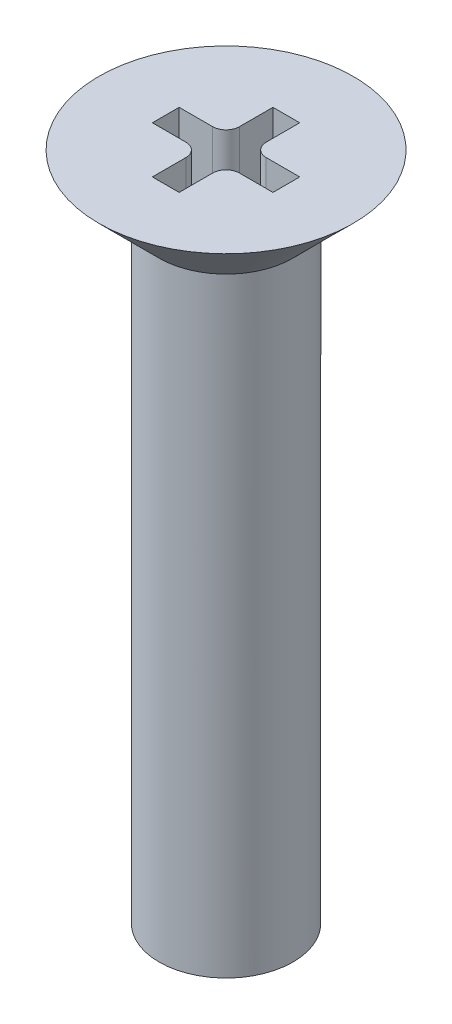
from build123d import *

# Parameters (mm, degrees)
BOSS_EXTRUDE1_START = 8.8
SKETCH2_R           = 1
BOSS_EXTRUDE1_DEPTH = 8.8
CUT_EXTRUDE1_DEPTH  = 1


with BuildPart() as part:
    # Sketch1 → Revolve1 (revolve)
    with BuildSketch(Plane(origin=(0, 0, 0), x_dir=(0, 0, -1), z_dir=(1, 0, 0))):
        Polygon((0, 0), (-1.9, 0), (-1, -0.9), (-1, -1.2), (0, -1.2), align=None)
    revolve(axis=Axis((0, 0.872326939, 0), (0, -1, 0)))

    # Sketch2 → Boss-Extrude1 (add)
    with BuildSketch(Plane.XZ.offset(1.2).offset(BOSS_EXTRUDE1_START)):
        with Locations(Location((0, 0, 0), (0, 0, 90))):
            Circle(SKETCH2_R)
    extrude(amount=-BOSS_EXTRUDE1_DEPTH)

    # Sketch3 → Cut-Extrude1 (cut)
    with BuildSketch(Plane(origin=(0, 0, 0), x_dir=(1, 0, 0), z_dir=(0, 1, 0))):
        with BuildLine():
            Line((-0.9, -0.2), (-0.4, -0.2))
            ThreePointArc((-0.4, -0.2), (-0.258578644, -0.258578644), (-0.2, -0.4))
            Line((-0.2, -0.4), (-0.2, -0.9))
            Line((-0.2, -0.9), (0.2, -0.9))
            Line((0.2, -0.9), (0.2, -0.4))
            ThreePointArc((0.2, -0.4), (0.258578644, -0.258578644), (0.4, -0.2))
            Line((0.4, -0.2), (0.9, -0.2))
            Line((0.9, -0.2), (0.9, 0.2))
            Line((0.9, 0.2), (0.4, 0.2))
            ThreePointArc((0.4, 0.2), (0.258578644, 0.258578644), (0.2, 0.4))
            Line((0.2, 0.4), (0.2, 0.9))
            Line((0.2, 0.9), (-0.2, 0.9))
            Line((-0.2, 0.9), (-0.2, 0.4))
            ThreePointArc((-0.2, 0.4), (-0.258578644, 0.258578644), (-0.4, 0.2))
            Line((-0.4, 0.2), (-0.9, 0.2))
            Line((-0.9, 0.2), (-0.9, -0.2))
        make_face()
    extrude(amount=-CUT_EXTRUDE1_DEPTH, mode=Mode.SUBTRACT)


solid = part.part
